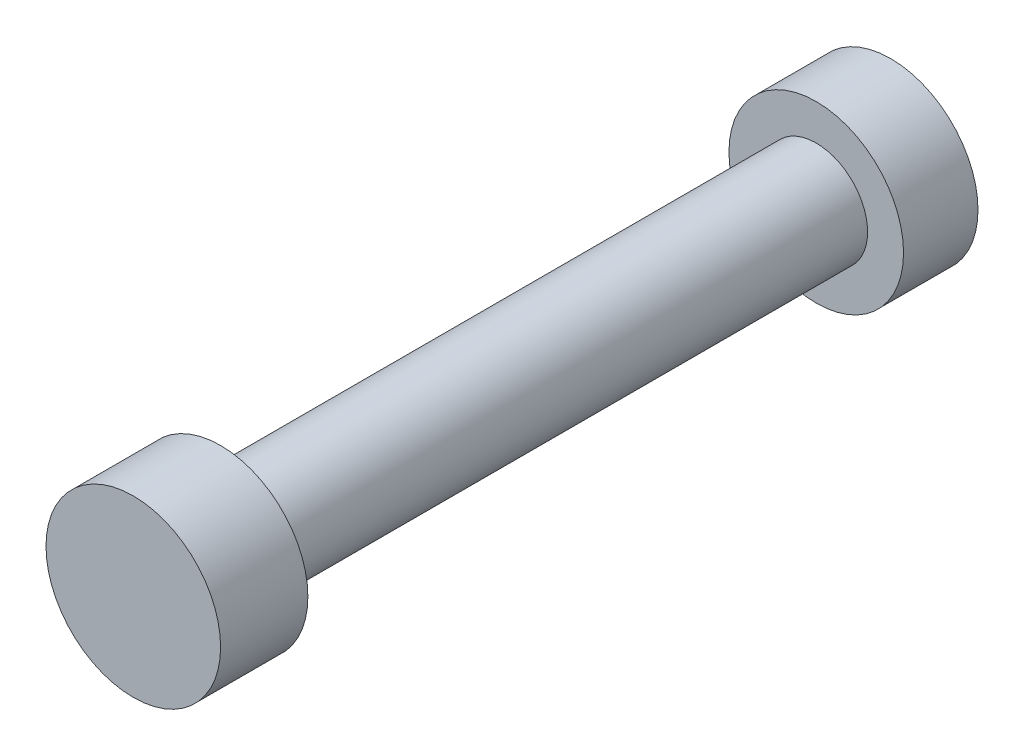
from build123d import *

# Parameters (mm, degrees)
M4_START                = 35.5
SKETCH1_R               = 2
M4_SHANK_AND_GRIP_DEPTH = 29.5
HEAD_START              = 61.6
SKETCH2_R               = 3.4
HEAD_DEPTH              = 3.4
LOCKNUT_START           = 35.5
SKETCH3_R               = 3.4
LOCKNUT_DEPTH           = 2.9


with BuildPart() as part:
    # Sketch1 → M4 shank and grip (new body)
    with BuildSketch(Plane.XY.offset(M4_START)):
        Circle(SKETCH1_R)
    extrude(amount=M4_SHANK_AND_GRIP_DEPTH)

    # Sketch2 → Head (add)
    with BuildSketch(Plane.XY.offset(HEAD_START)):
        Circle(SKETCH2_R)
    extrude(amount=HEAD_DEPTH)

    # Sketch3 → Locknut (add)
    with BuildSketch(Plane.XY.offset(LOCKNUT_START)):
        Circle(SKETCH3_R)
    extrude(amount=LOCKNUT_DEPTH)


solid = part.part
